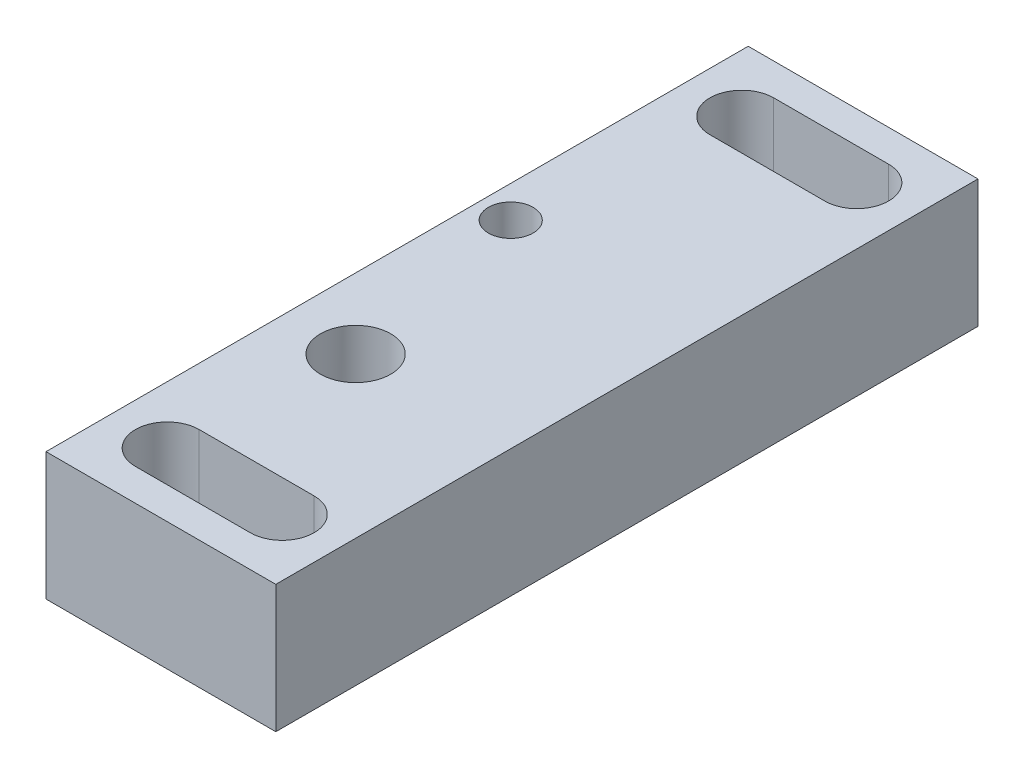
from build123d import *

# Parameters (mm, degrees)
SKETCH1_W           = 18
SKETCH1_H           = 55
BOSS_EXTRUDE1_DEPTH = 10
SKETCH2_R           = 2.75
SKETCH2_R_2         = 1.75
CUT_EXTRUDE1_DEPTH  = 31.61453903
SKETCH3_R           = 4.75
CUT_EXTRUDE2_DEPTH  = 5.5
CUT_EXTRUDE3_START  = -4
SKETCH4_R           = 1.75
CUT_EXTRUDE3_DEPTH  = 4
SKETCH5_R           = 2.5
CUT_EXTRUDE4_DEPTH  = 31.61453903


with BuildPart() as part:
    # Sketch1 → Boss-Extrude1 (new body)
    with BuildSketch(Plane(origin=(0, 0, 0), x_dir=(1, 0, 0), z_dir=(0, 1, 0))):
        Rectangle(SKETCH1_W, SKETCH1_H)
    extrude(amount=BOSS_EXTRUDE1_DEPTH)

    # Sketch2 → Cut-Extrude1 (cut, through all)
    with BuildSketch(Plane(origin=(0, 10, 0), x_dir=(1, 0, 0), z_dir=(0, 1, 0))):
        with Locations(Location((3.5, -8.75, 0), (0, 0, 270))):
            Circle(SKETCH2_R)
        with Locations(Location((6.5, 6.4, 0), (0, 0, 270))):
            Circle(SKETCH2_R_2)
    extrude(amount=-CUT_EXTRUDE1_DEPTH, mode=Mode.SUBTRACT)

    # Sketch3 → Cut-Extrude2 (cut)
    with BuildSketch(Plane.XZ):
        with Locations(Location((3.5, 8.75, 0), (0, 0, 270))):
            Circle(SKETCH3_R)
    extrude(amount=-CUT_EXTRUDE2_DEPTH, mode=Mode.SUBTRACT)

    # Sketch4 → Cut-Extrude3 (cut)
    # profile 1 of 3: a face of its own
    with BuildSketch(Plane.XZ.offset(CUT_EXTRUDE3_START)):
        with BuildLine():
            ThreePointArc((6.5, -3.4), (3.5, -6.4), (6.5, -9.4))
            ThreePointArc((6.5, -9.4), (7.918637165, -9.043382037), (9, -8.058312395))
            Line((9, -8.058312395), (9, -4.741687605))
            ThreePointArc((9, -4.741687605), (7.918637165, -3.756617963), (6.5, -3.4))
        make_face()
        with Locations(Location((6.5, -6.4, 0), (0, 0, 90))):
            Circle(SKETCH4_R, mode=Mode.SUBTRACT)
    # profile 2 of 3: a face of its own
    with BuildSketch(Plane.XZ.offset(CUT_EXTRUDE3_START)):
        with BuildLine():
            ThreePointArc((9, -8.058312395), (7.918637165, -9.043382037), (6.5, -9.4))
            Line((6.5, -9.4), (9, -9.4))
            Line((9, -9.4), (9, -8.058312395))
        make_face()
    # profile 3 of 3: a face of its own
    with BuildSketch(Plane.XZ.offset(CUT_EXTRUDE3_START)):
        with BuildLine():
            Line((9, -3.4), (6.5, -3.4))
            ThreePointArc((6.5, -3.4), (7.918637165, -3.756617963), (9, -4.741687605))
            Line((9, -4.741687605), (9, -3.4))
        make_face()
    extrude(amount=CUT_EXTRUDE3_DEPTH, mode=Mode.SUBTRACT)

    # Sketch5 → Cut-Extrude4 (cut, through all)
    with BuildSketch(Plane(origin=(0, 0, 0), x_dir=(1, 0, 0), z_dir=(0, 1, 0))):
        with Locations((-4.5, 22.5)):
            Circle(SKETCH5_R)
        with BuildLine():
            Line((4.5, 25), (-4.5, 25))
            ThreePointArc((-4.5, 25), (-2.732233047, 24.267766953), (-2, 22.5))
            ThreePointArc((-2, 22.5), (-2.732233047, 20.732233047), (-4.5, 20))
            Line((-4.5, 20), (4.5, 20))
            ThreePointArc((4.5, 20), (2, 22.5), (4.5, 25))
        make_face()
        with Locations((4.5, 22.5)):
            Circle(SKETCH5_R)
        with Locations((-4.5, -22.5)):
            Circle(SKETCH5_R)
        with BuildLine():
            ThreePointArc((4.5, -25), (2, -22.5), (4.5, -20))
            Line((4.5, -20), (-4.5, -20))
            ThreePointArc((-4.5, -20), (-2.732233047, -20.732233047), (-2, -22.5))
            ThreePointArc((-2, -22.5), (-2.732233047, -24.267766953), (-4.5, -25))
            Line((-4.5, -25), (4.5, -25))
        make_face()
        with Locations((4.5, -22.5)):
            Circle(SKETCH5_R)
    extrude(amount=CUT_EXTRUDE4_DEPTH, mode=Mode.SUBTRACT)


with BuildPart() as body_2:
    # Mirror2: mirrored copy
    add(part.part.mirror(Plane(origin=(0, 0, 0), x_dir=(0, 0, 1), z_dir=(1, 0, 0))))


solid = body_2.part
